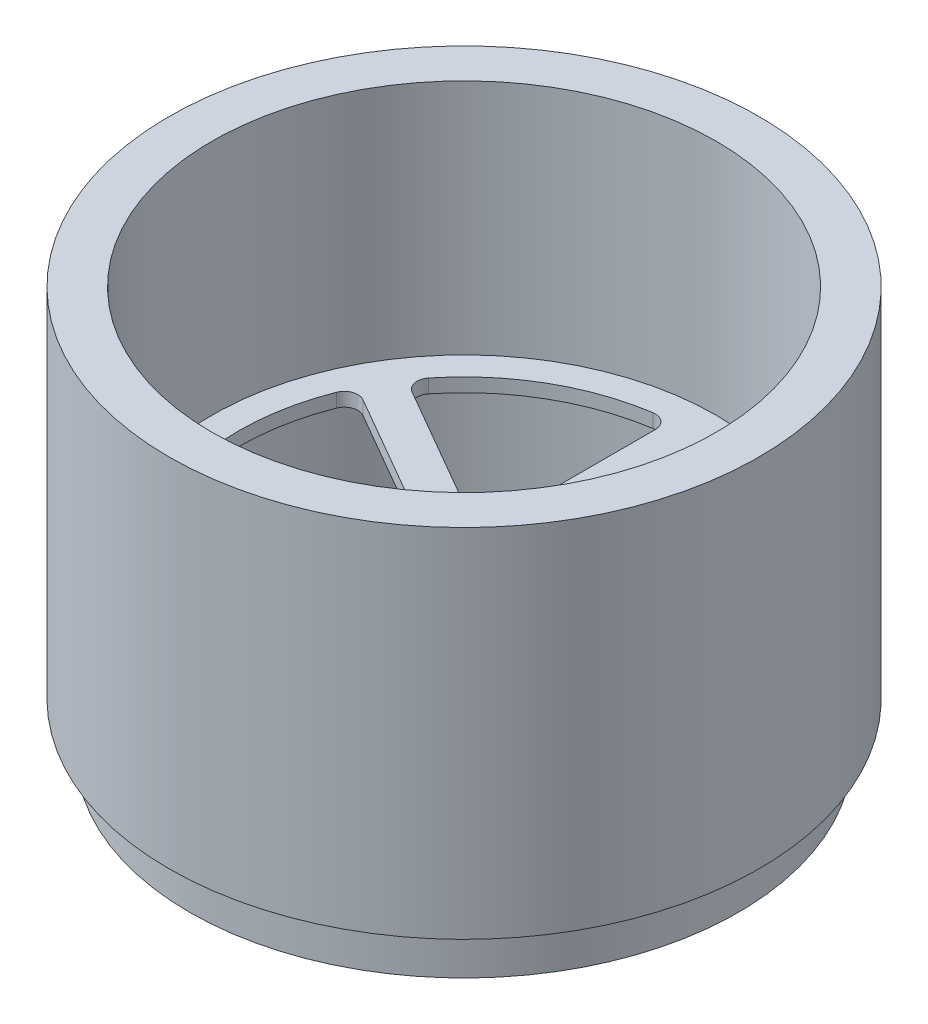
from build123d import *

# Parameters (mm, degrees)
SKETCH1_R           = 21.5
SKETCH1_R_2         = 18.38
BOSS_EXTRUDE1_DEPTH = 29.5
SKETCH3_R           = 21.5
BOSS_EXTRUDE2_DEPTH = 1
SKETCH4_R           = 2
SKETCH4_R_2         = 0.75
BOSS_EXTRUDE3_DEPTH = 3.8
SKETCH5_OUTSIDE_W   = 58.518
SKETCH5_OUTSIDE_H   = 58.518
SKETCH5_OUTSIDE_R   = 20
CUT_EXTRUDE1_DEPTH  = 3.5
CUT_EXTRUDE2_REACH  = 37.488
CIRPATTERN1_COUNT   = 6


with BuildPart() as part:
    # Sketch1 → Boss-Extrude1 (new body)
    with BuildSketch(Plane(origin=(0, 0, 0), x_dir=(1, 0, 0), z_dir=(0, 1, 0))):
        with Locations(Location((0, 0, 0), (0, 0, 270))):
            Circle(SKETCH1_R)
        with Locations(Location((0, 0, 0), (0, 0, 270))):
            Circle(SKETCH1_R_2, mode=Mode.SUBTRACT)
    extrude(amount=BOSS_EXTRUDE1_DEPTH)

    # Sketch3 → Boss-Extrude2 (add)
    with BuildSketch(Plane(origin=(0, 11.2, 0), x_dir=(-1, 0, 0), z_dir=(0, -1, 0))):
        with Locations(Location((0, 0, 0), (0, 0, 270))):
            Circle(SKETCH3_R)
    extrude(amount=-BOSS_EXTRUDE2_DEPTH)

    # Sketch4 → Boss-Extrude3 (add)
    with BuildSketch(Plane(origin=(0, 11.2, 0), x_dir=(-1, 0, 0), z_dir=(0, -1, 0))):
        with Locations(Location((0, 0, 0), (0, 0, 270))):
            Circle(SKETCH4_R)
        with Locations(Location((0, 0, 0), (0, 0, 270))):
            Circle(SKETCH4_R_2, mode=Mode.SUBTRACT)
    extrude(amount=BOSS_EXTRUDE3_DEPTH)

    # Sketch5 outside → Cut-Extrude1 (cut)
    with BuildSketch(Plane(origin=(0, 0, 0), x_dir=(1, 0, 0), z_dir=(0, 1, 0))):
        Rectangle(SKETCH5_OUTSIDE_W, SKETCH5_OUTSIDE_H)
        with Locations(Location((0, 0, 0), (0, 0, 270))):
            Circle(SKETCH5_OUTSIDE_R, mode=Mode.SUBTRACT)
    extrude(amount=CUT_EXTRUDE1_DEPTH, mode=Mode.SUBTRACT)

    # Sketch6 → Cut-Extrude2 (cut, up to next)
    with BuildSketch(Plane(origin=(0, 11.2, 0), x_dir=(-1, 0, 0), z_dir=(0, -1, 0)), mode=Mode.PRIVATE) as cut_extrude2_sk1:
        with BuildLine():
            Line((1.311528297, -4.358954791), (1.311528297, -15.245444515))
            ThreePointArc((1.311528297, -15.245444515), (1.659572625, -16.003701596), (2.461435901, -16.234144525))
            ThreePointArc((2.461435901, -16.234144525), (8.209843408, -14.219865905), (12.828463617, -10.248738282))
            ThreePointArc((12.828463617, -10.248738282), (13.029825824, -9.439082851), (12.547178093, -8.75853908))
            Line((12.547178093, -8.75853908), (3.119201435, -3.315294219))
            ThreePointArc((3.119201435, -3.315294219), (2.601197124, -3.181481713), (2.088346263, -3.333857065))
            ThreePointArc((2.088346263, -3.333857065), (1.966964225, -3.406881974), (1.843031779, -3.475489448))
            ThreePointArc((1.843031779, -3.475489448), (1.454645424, -3.843443646), (1.311528297, -4.358954791))
        make_face()
    cut_extrude2_tool1 = extrude(cut_extrude2_sk1.sketch, amount=-CUT_EXTRUDE2_REACH, mode=Mode.PRIVATE) & part.part
    cut_extrude2 = cut_extrude2_tool1.solids().sort_by_distance((-5.765973, 11.2, 9.986958))[0]
    add(cut_extrude2, mode=Mode.SUBTRACT)

    # CirPattern1: Cut-Extrude2 ×6 about axis
    cirpattern1_axis = Axis((0, 0, 0), (0, 1, 0))
    for i in range(1, CIRPATTERN1_COUNT):
        add(cut_extrude2.rotate(cirpattern1_axis, i * 360 / CIRPATTERN1_COUNT), mode=Mode.SUBTRACT)


solid = part.part
